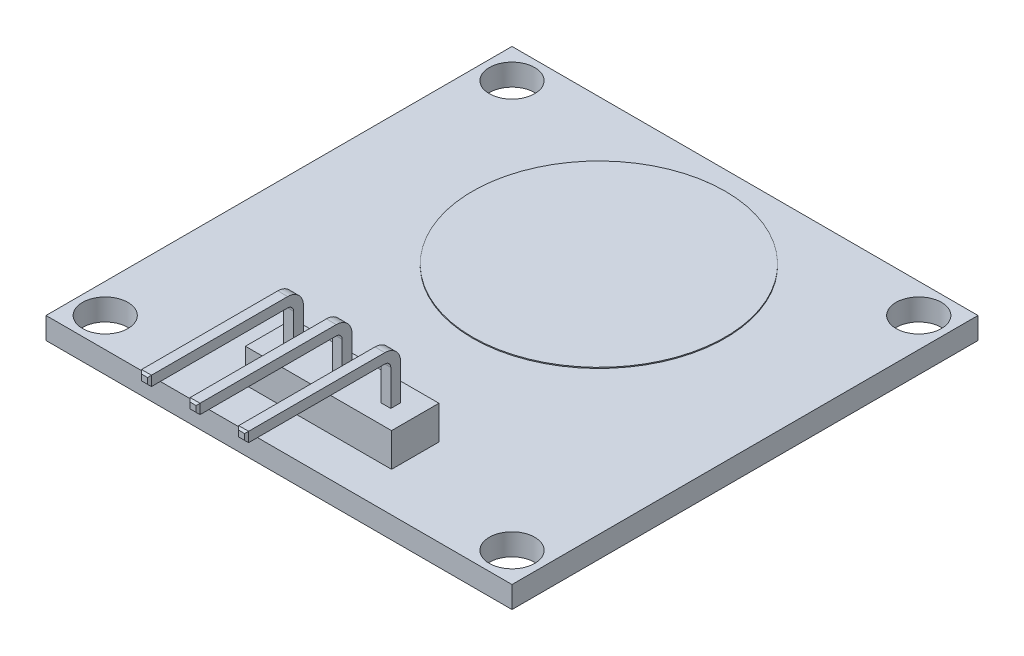
from build123d import *

# Parameters (mm, degrees)
SKETCH_1_W                         = 23.6
SKETCH_1_H                         = 23.6
EXTRUDE_1_DEPTH                    = 1.1
CUT_EXTRUDE_1_REACH                = 18.724
SKETCH_2_R                         = 1.15
MIRROR_2_COPY_1_REACH              = 18.724
MIRROR_2_COPY_1_SKETCH_R           = 1.15
SKETCH_3_W                         = 7.4
SKETCH_3_H                         = 2.4
EXTRUDE_2_DEPTH                    = 1.7
EXTRUDE_3_DEPTH                    = 0.25
CHAMFER_7_SIZE                     = 0.1
FILLET_1_R                         = 0.3
FILLET_2_R                         = 0.8
PATTERN_LINEAR_2_COUNT             = 2
PATTERN_LINEAR_2_PITCH             = 2.46
CHAMFER_7_OF_PATTERN_LINEAR_2_SIZE = 0.1
FILLET_1_OF_PATTERN_LINEAR_2_R     = 0.3
FILLET_2_OF_PATTERN_LINEAR_2_R     = 0.8
PATTERN_LINEAR_3_COUNT             = 2
PATTERN_LINEAR_3_PITCH             = 2.46
CHAMFER_7_OF_PATTERN_LINEAR_3_SIZE = 0.1
FILLET_1_OF_PATTERN_LINEAR_3_R     = 0.3
FILLET_2_OF_PATTERN_LINEAR_3_R     = 0.8
EXTRUDE_START                      = 0.55
SKETCH_7_R                         = 6.4
EXTRUDE_10_DEPTH                   = 0.6
SKETCH_8_W                         = 8.601343457
SKETCH_8_H                         = 2.116418894
CUT_EXTRUDE_2125_DEPTH             = 1.6


with BuildPart() as part:
    # 草图1 → 凸台-拉伸1 (new body)
    with BuildSketch(Plane(origin=(0, 0, 0), x_dir=(1, 0, 0), z_dir=(0, 1, 0))):
        Rectangle(SKETCH_1_W, SKETCH_1_H)
    extrude(amount=EXTRUDE_1_DEPTH)

    # 草图2 → 切除-拉伸1 (cut, up to next)
    with BuildSketch(Plane(origin=(0, 1.1, 0), x_dir=(1, 0, 0), z_dir=(0, 1, 0)), mode=Mode.PRIVATE) as cut_extrude_1_sk1:
        with Locations(Location((10.3, -10.3, 0), (0, 0, 270))):
            Circle(SKETCH_2_R)
    cut_extrude_1_tool1 = extrude(cut_extrude_1_sk1.sketch, amount=-CUT_EXTRUDE_1_REACH, mode=Mode.PRIVATE) & part.part
    cut_extrude_1 = cut_extrude_1_tool1.solids().sort_by_distance((10.3, 1.1, 10.3))[0]
    add(cut_extrude_1, mode=Mode.SUBTRACT)

    # 镜向1: 切除-拉伸1 across plane
    add(cut_extrude_1.mirror(Plane(origin=(0, 0, 0), x_dir=(0, 0, 1), z_dir=(1, 0, 0))), mode=Mode.SUBTRACT)

    # 镜向2: 切除-拉伸1 across plane
    add(cut_extrude_1.mirror(Plane.XY), mode=Mode.SUBTRACT)

    # 镜向2 copy 1 sketch → 镜向2 copy 1 (cut, up to next)
    with BuildSketch(Plane(origin=(0, 1.1, 0), x_dir=(-1, 0, 0), z_dir=(0, 1, 0)), mode=Mode.PRIVATE) as mirror_2_copy_1_sk1:
        with Locations(Location((10.3, -10.3, 0), (0, 0, 270))):
            Circle(MIRROR_2_COPY_1_SKETCH_R)
    mirror_2_copy_1_tool1 = extrude(mirror_2_copy_1_sk1.sketch, amount=-MIRROR_2_COPY_1_REACH, mode=Mode.PRIVATE) & part.part
    add(mirror_2_copy_1_tool1.solids().sort_by_distance((-10.3, 1.1, -10.3))[0], mode=Mode.SUBTRACT)

    # 草图3 → 凸台-拉伸2 (add)
    with BuildSketch(Plane(origin=(0, 1.1, 0), x_dir=(1, 0, 0), z_dir=(0, 1, 0))):
        with Locations((0, -8.6)):
            Rectangle(SKETCH_3_W, SKETCH_3_H)
    extrude(amount=EXTRUDE_2_DEPTH)

    # 草图4 → 凸台-拉伸3 (add, symmetric)
    with BuildSketch(Plane(origin=(0, 0, 0), x_dir=(0, 0, -1), z_dir=(1, 0, 0))):
        Polygon((-8.35, -1.6), (-8.35, 5.4), (-16.15, 5.4), (-16.15, 4.9), (-8.85, 4.9), (-8.85, -1.6), align=None)
    extrude_3 = extrude(amount=EXTRUDE_3_DEPTH, both=True)

    # 倒角7
    chamfer_7_edges = [part.edges().sort_by_distance(p)[0] for p in [
        (0, -1.6, 8.35),
        (0.25, -1.6, 8.6),
        (-0.25, -1.6, 8.6),
        (0, -1.6, 8.85),
        (-0.25, 5.15, 16.15),
        (0, 5.4, 16.15),
        (0, 4.9, 16.15),
        (0.25, 5.15, 16.15),
    ]]
    chamfer(chamfer_7_edges, length=CHAMFER_7_SIZE)

    # 圆角1
    fillet_1_edges = [part.edges().sort_by_distance(p)[0] for p in [
        (0, 4.9, 8.85),
    ]]
    fillet(fillet_1_edges, radius=FILLET_1_R)

    # 圆角2
    fillet_2_edges = [part.edges().sort_by_distance(p)[0] for p in [
        (0, 5.4, 8.35),
    ]]
    fillet(fillet_2_edges, radius=FILLET_2_R)

    # 阵列(线性)2: 凸台-拉伸3 ×2
    with Locations(*[(i * PATTERN_LINEAR_2_PITCH, 0, 0) for i in range(1, PATTERN_LINEAR_2_COUNT)]):
        add(extrude_3)

    # 倒角7 of 阵列(线性)2
    chamfer_7_of_pattern_linear_2_edges = [part.edges().sort_by_distance(p)[0] for p in [
        (2.46, -1.6, 8.35),
        (2.71, -1.6, 8.6),
        (2.21, -1.6, 8.6),
        (2.46, -1.6, 8.85),
        (2.21, 5.15, 16.15),
        (2.46, 5.4, 16.15),
        (2.46, 4.9, 16.15),
        (2.71, 5.15, 16.15),
    ]]
    chamfer(chamfer_7_of_pattern_linear_2_edges, length=CHAMFER_7_OF_PATTERN_LINEAR_2_SIZE)

    # 圆角1 of 阵列(线性)2
    fillet_1_of_pattern_linear_2_edges = [part.edges().sort_by_distance(p)[0] for p in [
        (2.46, 4.9, 8.85),
    ]]
    fillet(fillet_1_of_pattern_linear_2_edges, radius=FILLET_1_OF_PATTERN_LINEAR_2_R)

    # 圆角2 of 阵列(线性)2
    fillet_2_of_pattern_linear_2_edges = [part.edges().sort_by_distance(p)[0] for p in [
        (2.46, 5.4, 8.35),
    ]]
    fillet(fillet_2_of_pattern_linear_2_edges, radius=FILLET_2_OF_PATTERN_LINEAR_2_R)

    # 阵列(线性)3: 凸台-拉伸3 ×2
    with Locations(*[(-i * PATTERN_LINEAR_3_PITCH, 0, 0) for i in range(1, PATTERN_LINEAR_3_COUNT)]):
        add(extrude_3)

    # 倒角7 of 阵列(线性)3
    chamfer_7_of_pattern_linear_3_edges = [part.edges().sort_by_distance(p)[0] for p in [
        (-2.46, -1.6, 8.35),
        (-2.21, -1.6, 8.6),
        (-2.71, -1.6, 8.6),
        (-2.46, -1.6, 8.85),
        (-2.71, 5.15, 16.15),
        (-2.46, 5.4, 16.15),
        (-2.46, 4.9, 16.15),
        (-2.21, 5.15, 16.15),
    ]]
    chamfer(chamfer_7_of_pattern_linear_3_edges, length=CHAMFER_7_OF_PATTERN_LINEAR_3_SIZE)

    # 圆角1 of 阵列(线性)3
    fillet_1_of_pattern_linear_3_edges = [part.edges().sort_by_distance(p)[0] for p in [
        (-2.46, 4.9, 8.85),
    ]]
    fillet(fillet_1_of_pattern_linear_3_edges, radius=FILLET_1_OF_PATTERN_LINEAR_3_R)

    # 圆角2 of 阵列(线性)3
    fillet_2_of_pattern_linear_3_edges = [part.edges().sort_by_distance(p)[0] for p in [
        (-2.46, 5.4, 8.35),
    ]]
    fillet(fillet_2_of_pattern_linear_3_edges, radius=FILLET_2_OF_PATTERN_LINEAR_3_R)

    # 草图7 → 凸台-拉伸10 (add, symmetric)
    with BuildSketch(Plane(origin=(0, 0, 0), x_dir=(1, 0, 0), z_dir=(0, 1, 0)).offset(EXTRUDE_START)):
        with Locations(Location((0, 4.4, 0), (0, 0, 270))):
            Circle(SKETCH_7_R)
    extrude(amount=EXTRUDE_10_DEPTH, both=True)

    # 草图8 → Cut-Extrude 2125 (cut)
    with BuildSketch(Plane.XZ):
        with Locations((-0.203501817, 8.619224199)):
            Rectangle(SKETCH_8_W, SKETCH_8_H)
    extrude(amount=CUT_EXTRUDE_2125_DEPTH, mode=Mode.SUBTRACT)


solid = part.part
